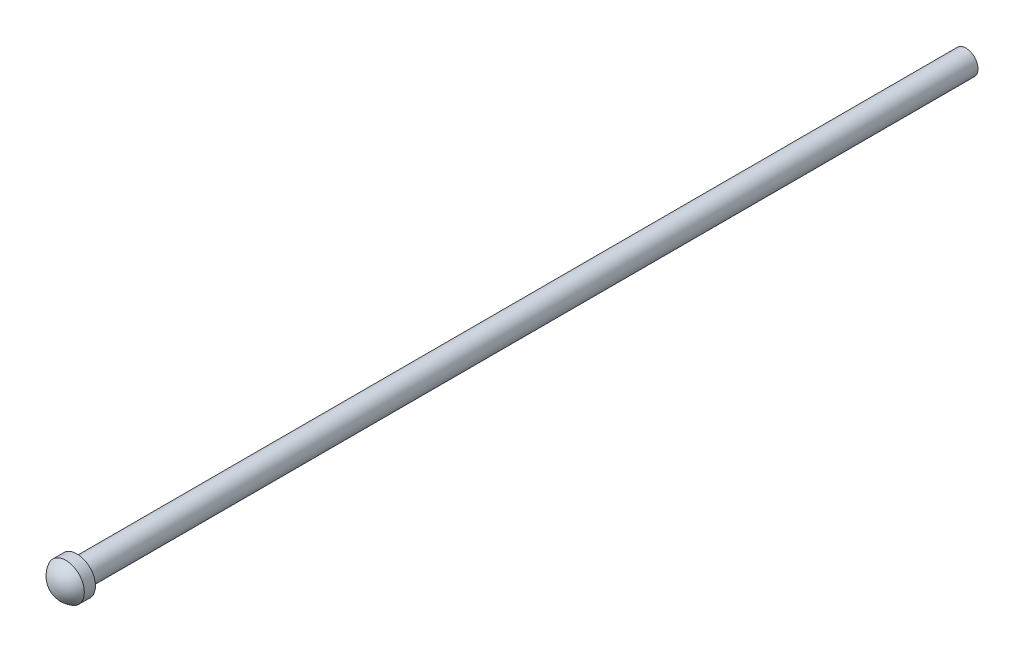
from build123d import *

# Parameters (mm, degrees)
SKETCH_1_R         = 3.25
SKETCH_3_R         = 5
EXTRUDE_1_DEPTH    = 3
DOME_1_FACE_RADIUS = 5
DOME_1_HEIGHT      = 3


with BuildPart() as part:
    # По траектории1: sweep along a path in Эскиз2
    with BuildLine(Plane(origin=(0, 0, -120), x_dir=(0, 0, -1), z_dir=(1, 0, 0))) as sweep_1_path:
        Line((-120, 0), (120, 0))
    # Эскиз1 → По траектории1 (sweep)
    with BuildSketch(Plane.XY):
        with Locations((5, 60)):
            Circle(SKETCH_1_R)
    sweep(path=sweep_1_path.line)

    # Эскиз3 → Бобышка-Вытянуть1 (add)
    with BuildSketch(Plane.XY):
        with Locations((5, 60)):
            Circle(SKETCH_3_R)
    extrude(amount=EXTRUDE_1_DEPTH)

    # Купол1: a dome of height H over a round flat face of radius A is a cap of a sphere of radius (A * A + H * H) / (2 * H)
    dome_1_r = (DOME_1_FACE_RADIUS * DOME_1_FACE_RADIUS + DOME_1_HEIGHT * DOME_1_HEIGHT) / (2 * DOME_1_HEIGHT)
    dome_1_base = Plane((5, 60, 3), z_dir=(0, 0, 1))
    with Locations(dome_1_base.offset(DOME_1_HEIGHT - dome_1_r)):
        dome_1_ball = Sphere(dome_1_r, mode=Mode.PRIVATE)
    add(split(dome_1_ball, bisect_by=dome_1_base, keep=Keep.TOP, mode=Mode.PRIVATE))


solid = part.part
